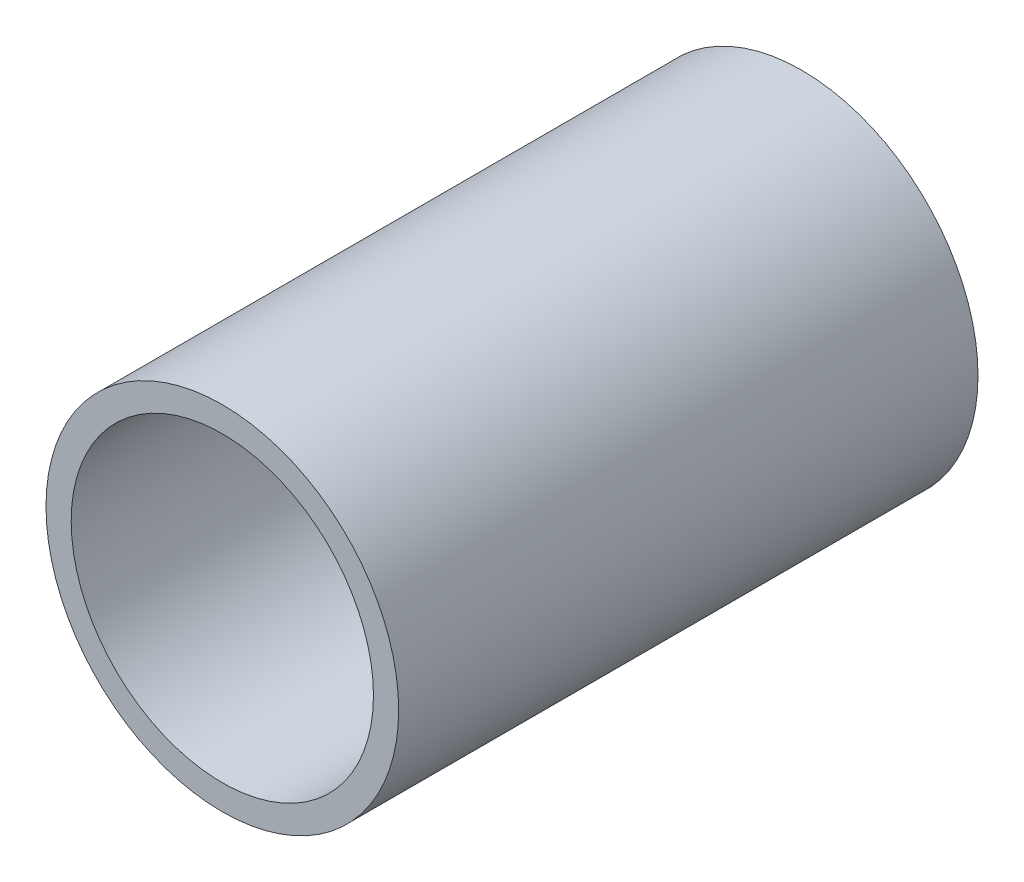
from build123d import *

# Parameters (mm, degrees)
BOSS_EXTRUDE1_DEPTH      = 914.4
BOSS_EXTRUDE1_DEPTH_BACK = 914.4
SKETCH1_R                = 22.225
SKETCH1_R_2              = 19.05
SKETCH3_R                = 22.225
CUT_EXTRUDE1_DEPTH       = 1755.775


with BuildPart() as part:
    # Sketch1 → Boss-Extrude1 (new, two sides: drawn at the far end of the back side and taken through both)
    with BuildSketch(Plane.XY.offset(-BOSS_EXTRUDE1_DEPTH_BACK)):
        with Locations(Location((0, 0, 0), (0, 0, 180))):
            Circle(SKETCH1_R)
        with Locations(Location((0, 0, 0), (0, 0, 180))):
            Circle(SKETCH1_R_2, mode=Mode.SUBTRACT)
    extrude(amount=BOSS_EXTRUDE1_DEPTH + BOSS_EXTRUDE1_DEPTH_BACK)

    # Sketch3 → Cut-Extrude1 (cut)
    with BuildSketch(Plane.XY.offset(914.4)):
        with Locations(Location((0, 0, 0), (0, 0, 180))):
            Circle(SKETCH3_R)
    extrude(amount=-CUT_EXTRUDE1_DEPTH, mode=Mode.SUBTRACT)


solid = part.part
